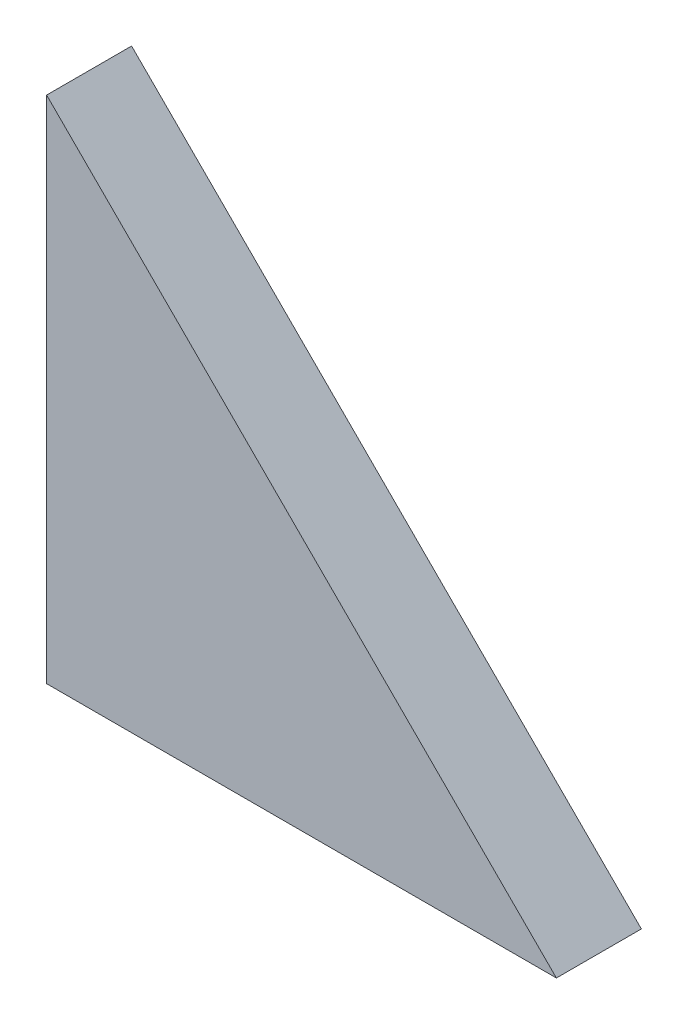
from build123d import *

# Parameters (mm, degrees)
BOSS_EXTRUDE1_DEPTH = 10


with BuildPart() as part:
    # Sketch1 → Boss-Extrude1 (new body)
    with BuildSketch(Plane.XY):
        Polygon((0, 60), (60, 0), (0, 0), align=None)
    extrude(amount=BOSS_EXTRUDE1_DEPTH)


solid = part.part
